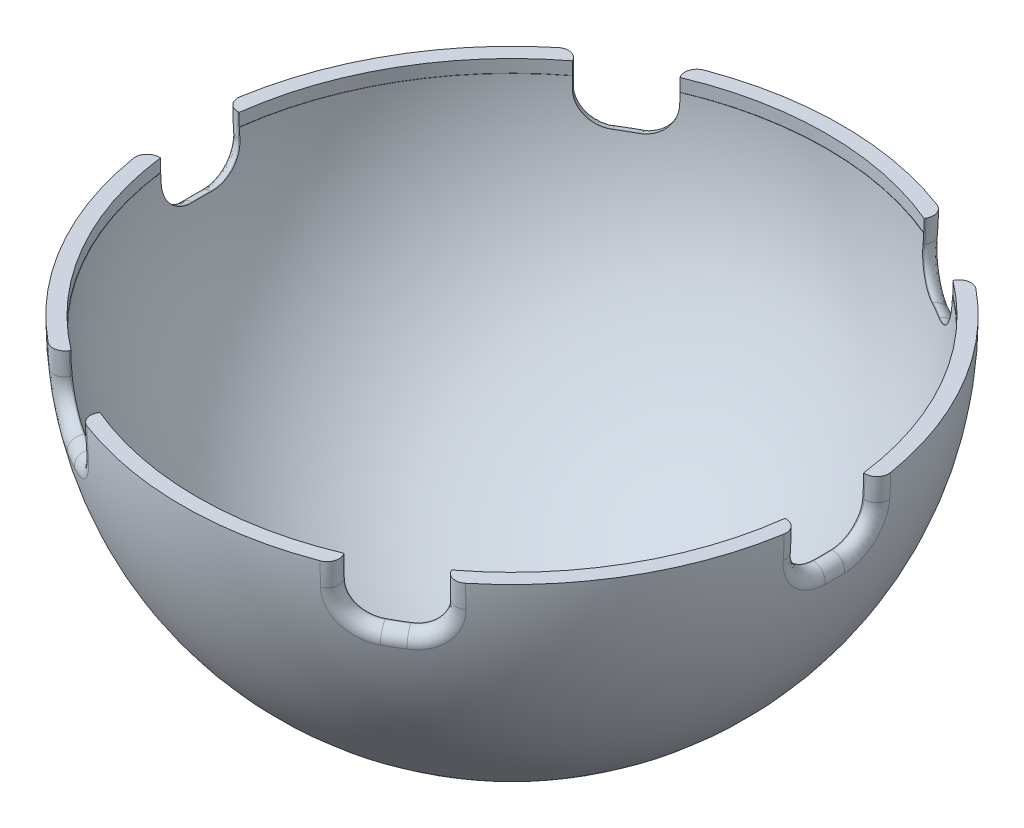
from build123d import *

# Parameters (mm, degrees)
SKETCH5_R                = 21
CUT_EXTRUDE1_DEPTH       = 0.85
SKETCH42_W               = 7.613205358
SKETCH42_H               = 5.25
CUT_EXTRUDE12_DEPTH      = 3.5
FILLET5_R                = 2
FILLET6_R                = 0.8
CIRPATTERN8_COUNT        = 6
FILLET5_OF_CIRPATTERN8_R = 2
FILLET6_OF_CIRPATTERN8_R = 0.8


with BuildPart() as part:
    # Sketch3 → Revolve1 (revolve)
    with BuildSketch(Plane.XY):
        with BuildLine():
            Line((-22, 0), (0, 0))
            Line((0, 0), (0, -22))
            ThreePointArc((0, -22), (-15.556349186, -15.556349186), (-22, 0))
        make_face()
    revolve(axis=Axis((0, 18.793797917, 0), (0, -1, 0)))

    # Sketch4 → Cut-Revolve1 (revolve, cut)
    with BuildSketch(Plane.XY):
        with BuildLine():
            Line((21, 0), (0, 0))
            Line((0, 0), (0, -21))
            ThreePointArc((0, -21), (14.849242405, -14.849242405), (21, 0))
        make_face()
    revolve(axis=Axis((0, 18.793797917, 0), (0, -1, 0)), mode=Mode.SUBTRACT)

    # Sketch5 → Cut-Extrude1 (cut)
    with BuildSketch(Plane(origin=(0, 0, 0), x_dir=(1, 0, 0), z_dir=(0, 1, 0))):
        Circle(SKETCH5_R)
    extrude(amount=-CUT_EXTRUDE1_DEPTH, mode=Mode.SUBTRACT)

    # Sketch42 → Cut-Extrude12 (cut)
    with BuildSketch(Plane(origin=(0, 0, 0), x_dir=(1, 0, 0), z_dir=(0, 1, 0))):
        with Locations((20.9624408, 0)):
            Rectangle(SKETCH42_W, SKETCH42_H)
    cut_extrude12 = extrude(amount=-CUT_EXTRUDE12_DEPTH, mode=Mode.SUBTRACT)

    # Fillet5
    fillet5_edges = [part.edges().sort_by_distance(p)[0] for p in [
        (21.049906641, -3.5, 2.625),
        (21.049906641, -3.5, -2.625),
    ]]
    fillet(fillet5_edges, radius=FILLET5_R)

    # Fillet6
    fillet6_edges = [part.edges().sort_by_distance(p)[0] for p in [
        (21.829938393, -0.75044303, 2.625),
        (21.710600664, -2.913520185, 2.039906598),
        (21.719806629, -3.5, 0),
        (21.710600664, -2.913520185, -2.039906598),
        (21.829938393, -0.75044303, -2.625),
    ]]
    fillet(fillet6_edges, radius=FILLET6_R)

    # CirPattern8: Cut-Extrude12 ×6 about axis
    cirpattern8_axis = Axis((0, 18.793797917, 0), (0, -1, 0))
    for i in range(1, CIRPATTERN8_COUNT):
        add(cut_extrude12.rotate(cirpattern8_axis, i * 360 / CIRPATTERN8_COUNT), mode=Mode.SUBTRACT)

    # Fillet5 of CirPattern8
    fillet5_of_cirpattern8_edges = [part.edges().sort_by_distance(p)[0] for p in [
        (8.251636636, -3.5, 19.542253898),
        (12.798270005, -3.5, 16.917253898),
        (-12.798270005, -3.5, 16.917253898),
        (-8.251636636, -3.5, 19.542253898),
        (-21.049906641, -3.5, -2.625),
        (-21.049906641, -3.5, 2.625),
        (-8.251636636, -3.5, -19.542253898),
        (-12.798270005, -3.5, -16.917253898),
        (12.798270005, -3.5, -16.917253898),
        (8.251636636, -3.5, -19.542253898),
    ]]
    fillet(fillet5_of_cirpattern8_edges, radius=FILLET5_OF_CIRPATTERN8_R)

    # Fillet6 of CirPattern8
    fillet6_of_cirpattern8_edges = [part.edges().sort_by_distance(p)[0] for p in [
        (8.641652512, -0.75044303, 20.217781212),
        (9.088689396, -2.913520185, 19.821885006),
        (10.859903314, -3.5, 18.809904306),
        (12.621911268, -2.913520185, 17.781978407),
        (13.188285882, -0.75044303, 17.592781212),
        (-13.188285882, -0.75044303, 17.592781212),
        (-12.621911268, -2.913520185, 17.781978407),
        (-10.859903314, -3.5, 18.809904306),
        (-9.088689396, -2.913520185, 19.821885006),
        (-8.641652512, -0.75044303, 20.217781212),
        (-21.829938393, -0.75044303, -2.625),
        (-21.710600664, -2.913520185, -2.039906598),
        (-21.719806629, -3.5, 0),
        (-21.710600664, -2.913520185, 2.039906598),
        (-21.829938393, -0.75044303, 2.625),
        (-8.641652512, -0.75044303, -20.217781212),
        (-9.088689396, -2.913520185, -19.821885006),
        (-10.859903314, -3.5, -18.809904306),
        (-12.621911268, -2.913520185, -17.781978407),
        (-13.188285882, -0.75044303, -17.592781212),
        (13.188285882, -0.75044303, -17.592781212),
        (12.621911268, -2.913520185, -17.781978407),
        (10.859903314, -3.5, -18.809904306),
        (9.088689396, -2.913520185, -19.821885006),
        (8.641652512, -0.75044303, -20.217781212),
    ]]
    fillet(fillet6_of_cirpattern8_edges, radius=FILLET6_OF_CIRPATTERN8_R)


solid = part.part
